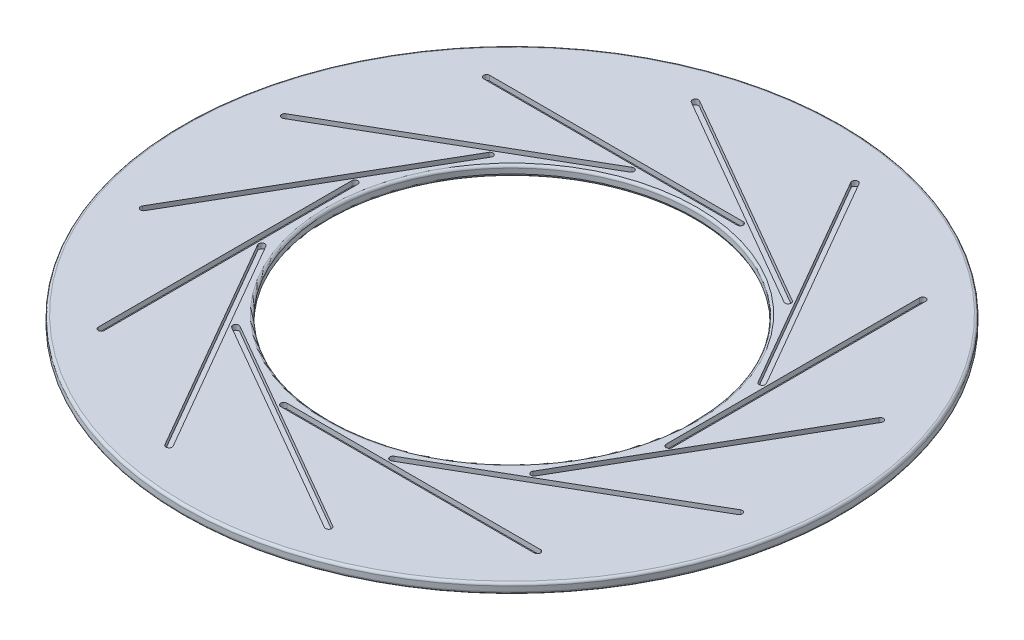
from build123d import *

# Parameters (mm, degrees)
SKETCH2_R            = 65
SKETCH2_R_2          = 36
RING_EXTRUSION_DEPTH = 2
GROOVES_DEPTH        = 1
CIRPATTERN2_COUNT    = 12
FILLET3_R            = 0.5


with BuildPart() as part:
    # Sketch2 → ring extrusion (new body)
    with BuildSketch(Plane(origin=(0, 0, 0), x_dir=(1, 0, 0), z_dir=(0, 1, 0))):
        with Locations(Location((0, 0, 0), (0, 0, 270))):
            Circle(SKETCH2_R)
        with Locations(Location((0, 0, 0), (0, 0, 270))):
            Circle(SKETCH2_R_2, mode=Mode.SUBTRACT)
    extrude(amount=RING_EXTRUSION_DEPTH)

    # Sketch5 → grooves (cut)
    with BuildSketch(Plane(origin=(0, 2, 0), x_dir=(1, 0, 0), z_dir=(0, 1, 0))):
        with BuildLine():
            Line((-43, 38.6), (7, 38.6))
            ThreePointArc((7, 38.6), (7.6, 38), (7, 37.4))
            Line((7, 37.4), (-43, 37.4))
            ThreePointArc((-43, 37.4), (-43.6, 38), (-43, 38.6))
        make_face()
    grooves = extrude(amount=-GROOVES_DEPTH, mode=Mode.SUBTRACT)

    # CirPattern2: grooves ×12 about axis
    cirpattern2_axis = Axis((0, 0, 0), (0, 1, 0))
    for i in range(1, CIRPATTERN2_COUNT):
        add(grooves.rotate(cirpattern2_axis, i * 360 / CIRPATTERN2_COUNT), mode=Mode.SUBTRACT)

    # Fillet3
    fillet3_edges = [part.edges().sort_by_distance(p)[0] for p in [
        (0, 0, -65),
        (0, 2, -65),
        (0, 0, -36),
        (0, 2, -36),
    ]]
    fillet(fillet3_edges, radius=FILLET3_R)


solid = part.part
